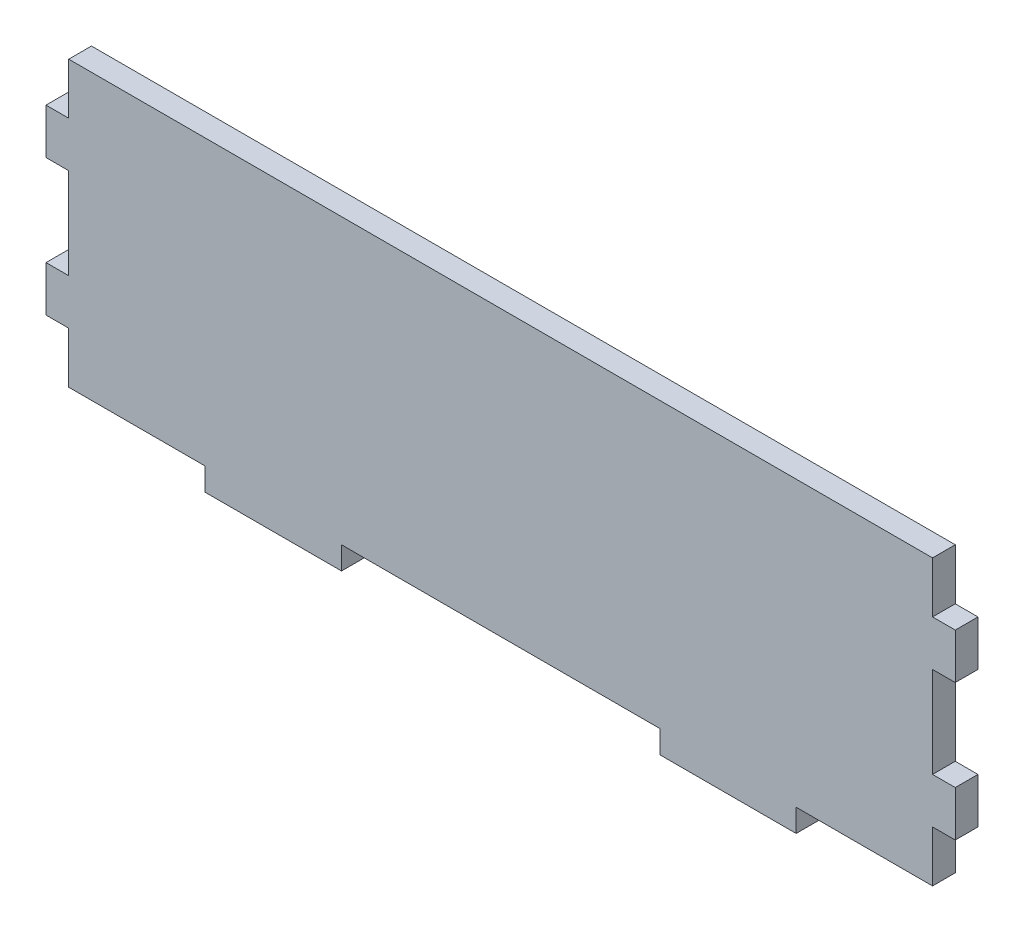
from build123d import *

# Parameters (mm, degrees)
SKETCH1_W           = 193.04
SKETCH1_H           = 63.5
BOSS_EXTRUDE1_DEPTH = 5.08
SKETCH2_W           = 5.08
SKETCH2_H           = 10.16
BOSS_EXTRUDE2_DEPTH = 5.08
SKETCH3_W           = 30.48
SKETCH3_H           = 5.08
BOSS_EXTRUDE3_DEPTH = 5.08


with BuildPart() as part:
    # Sketch1 → Boss-Extrude1 (new body)
    with BuildSketch(Plane.XY):
        with Locations((0, -31.75)):
            Rectangle(SKETCH1_W, SKETCH1_H)
    extrude(amount=-BOSS_EXTRUDE1_DEPTH)

    # Sketch2 → Boss-Extrude2 (add)
    with BuildSketch(Plane.XY):
        with Locations((99.06, -46.99)):
            Rectangle(SKETCH2_W, SKETCH2_H)
        with Locations((99.06, -16.51)):
            Rectangle(SKETCH2_W, SKETCH2_H)
        with Locations((-99.06, -46.99)):
            Rectangle(SKETCH2_W, SKETCH2_H)
        with Locations((-99.06, -16.51)):
            Rectangle(SKETCH2_W, SKETCH2_H)
    extrude(amount=-BOSS_EXTRUDE2_DEPTH)

    # Sketch3 → Boss-Extrude3 (add)
    with BuildSketch(Plane.XZ.offset(63.5)):
        with Locations((50.8, -2.54)):
            Rectangle(SKETCH3_W, SKETCH3_H)
        with Locations((-50.8, -2.54)):
            Rectangle(SKETCH3_W, SKETCH3_H)
    extrude(amount=BOSS_EXTRUDE3_DEPTH)


solid = part.part
